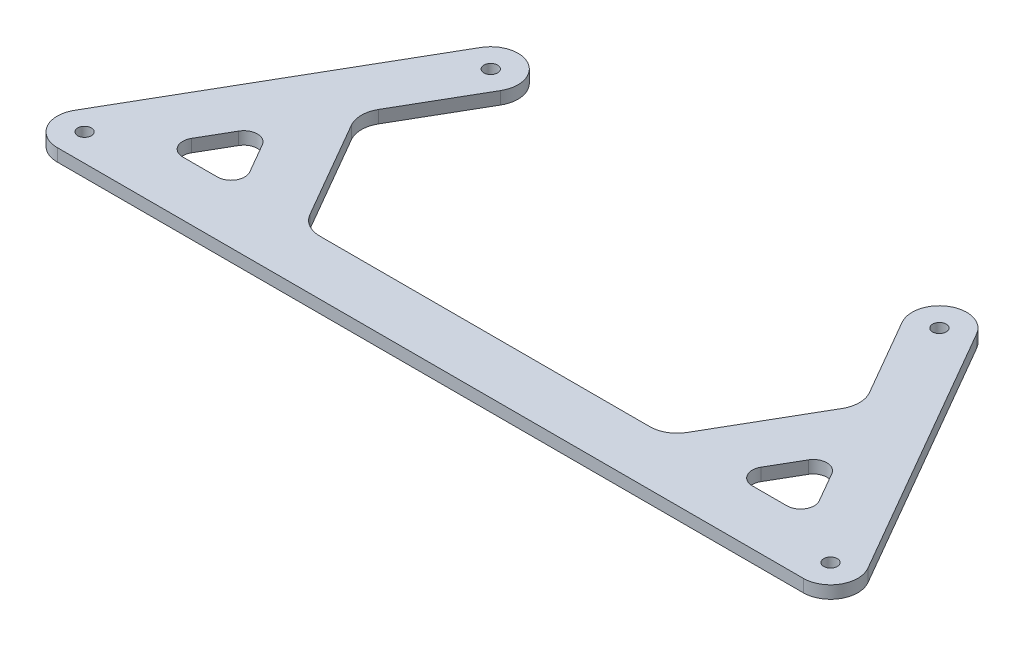
from build123d import *

# Parameters (mm, degrees)
SKETCH1_R           = 3.175
BOSS_EXTRUDE1_DEPTH = 5.842
FILLET1_R           = 6.35
FILLET2_R           = 12.7


with BuildPart() as part:
    # Sketch1 → Boss-Extrude1 (new body)
    with BuildSketch(Plane(origin=(0, 0, 0), x_dir=(1, 0, 0), z_dir=(0, 1, 0))):
        with BuildLine():
            Line((-115.350561828, 126.131830356), (-184.506633828, 6.35))
            ThreePointArc((-184.506633828, 6.35), (-184.506633828, -6.35), (-173.5081112, -12.7))
            Line((-173.5081112, -12.7), (173.5081112, -12.7))
            ThreePointArc((173.5081112, -12.7), (184.506633828, -6.35), (184.506633828, 6.35))
            Line((184.506633828, 6.35), (115.350561828, 126.131830356))
            ThreePointArc((115.350561828, 126.131830356), (98.0020392, 130.780352984), (93.353516572, 113.431830356))
            Line((93.353516572, 113.431830356), (117.796369106, 71.095567884))
            Line((117.796369106, 71.095567884), (84.081672269, 12.7))
            Line((84.081672269, 12.7), (-84.081672269, 12.7))
            Line((-84.081672269, 12.7), (-117.796369106, 71.095567884))
            Line((-117.796369106, 71.095567884), (-93.353516572, 113.431830356))
            ThreePointArc((-93.353516572, 113.431830356), (-98.0020392, 130.780352984), (-115.350561828, 126.131830356))
        make_face()
        with Locations(Location((-173.5081112, 0, 0), (0, 0, 270))):
            Circle(SKETCH1_R, mode=Mode.SUBTRACT)
        with Locations(Location((-104.3520392, 119.781830356, 0), (0, 0, 270))):
            Circle(SKETCH1_R, mode=Mode.SUBTRACT)
        with Locations(Location((104.3520392, 119.781830356, 0), (0, 0, 90))):
            Circle(SKETCH1_R, mode=Mode.SUBTRACT)
        with Locations(Location((173.5081112, 0, 0), (0, 0, 90))):
            Circle(SKETCH1_R, mode=Mode.SUBTRACT)
        Polygon((151.511065944, 12.7), (113.411065944, 12.7), (132.461065944, 45.695567884), align=None, mode=Mode.SUBTRACT)
        Polygon((-132.461065944, 45.695567884), (-113.411065944, 12.7), (-151.511065944, 12.7), align=None, mode=Mode.SUBTRACT)
    extrude(amount=BOSS_EXTRUDE1_DEPTH)

    # Fillet1
    fillet1_edges = [part.edges().sort_by_distance(p)[0] for p in [
        (151.511065944, 2.921, -12.7),
        (132.461065944, 2.921, -45.695567884),
        (113.411065944, 2.921, -12.7),
        (-132.461065944, 2.921, -45.695567884),
        (-151.511065944, 2.921, -12.7),
        (-113.411065944, 2.921, -12.7),
    ]]
    fillet(fillet1_edges, radius=FILLET1_R)

    # Fillet2
    fillet2_edges = [part.edges().sort_by_distance(p)[0] for p in [
        (-117.796369106, 2.921, -71.095567884),
        (-84.081672269, 2.921, -12.7),
        (84.081672269, 2.921, -12.7),
        (117.796369106, 2.921, -71.095567884),
    ]]
    fillet(fillet2_edges, radius=FILLET2_R)


solid = part.part
